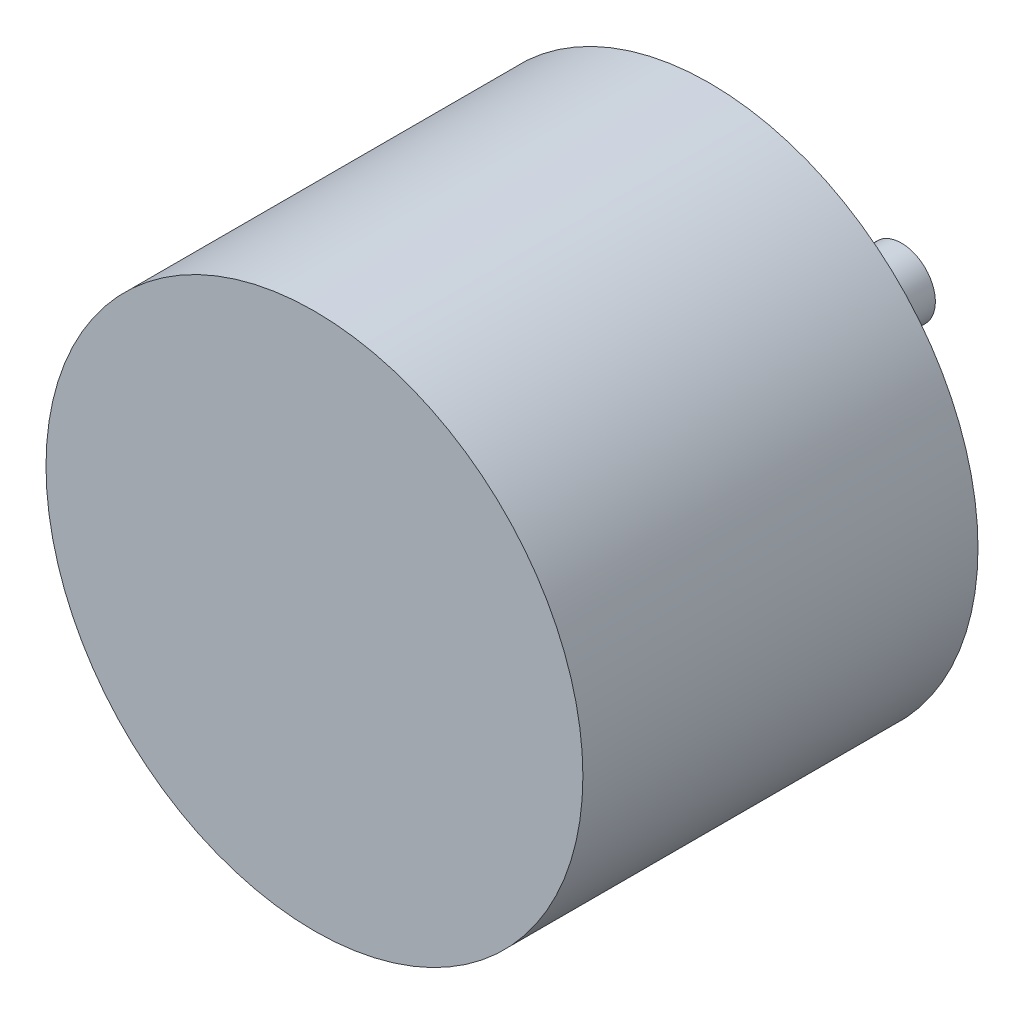
from build123d import *

# Parameters (mm, degrees)
SKETCH2_R          = 2
CUT_EXTRUDE1_DEPTH = 10


with BuildPart() as part:
    # Sketch1 → Revolve1 (revolve)
    with BuildSketch(Plane(origin=(0, 0, 0), x_dir=(1, 0, 0), z_dir=(0, 1, 0)), mode=Mode.PRIVATE) as revolve1_sk:
        Polygon((-36.90300646, -9.632836954), (-13.12300646, -9.632836954), (-13.12300646, 25.367163046), (-26.90300646, 25.367163046), (-26.90300646, 29.367163046), (-33.90300646, 29.367163046), (-33.90300646, 42.367163046), (-36.90300646, 42.367163046), align=None)
    revolve(revolve1_sk.sketch.rotate(Axis((-36.90300646, 0, -63.116337875), (0, 0, 1)), 180), axis=Axis((-36.90300646, 0, -63.116337875), (0, 0, 1)))

    # Sketch2 → Cut-Extrude1 (cut)
    with BuildSketch(Plane(origin=(0, 0, -25.367163046), x_dir=(-1, 0, 0), z_dir=(0, 0, -1))):
        with Locations((25.40300646, 11.5)):
            Circle(SKETCH2_R)
        with Locations((48.40300646, 11.5)):
            Circle(SKETCH2_R)
        with Locations((48.40300646, -11.5)):
            Circle(SKETCH2_R)
        with Locations((25.40300646, -11.5)):
            Circle(SKETCH2_R)
    extrude(amount=-CUT_EXTRUDE1_DEPTH, mode=Mode.SUBTRACT)


solid = part.part
